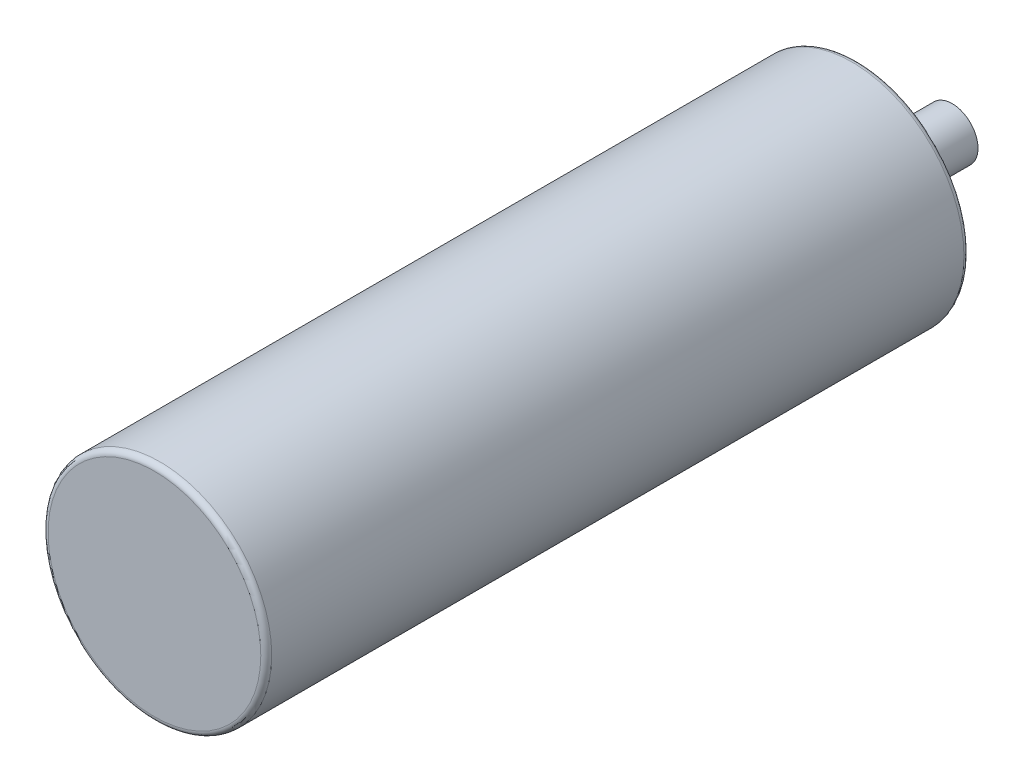
from build123d import *

# Parameters (mm, degrees)
SKETCH1_R                 = 26
BODY_DEPTH                = 163.5
SKETCH2_R                 = 6
AXLE_DEPTH                = 22
FLAT_START                = -15
SKETCH3_R                 = 1.016
FLAT_DEPTH                = 15
M5X0_8_TAPPED_HOLE1_D     = 4.2
M5X0_8_TAPPED_HOLE1_DEPTH = 32.0000122
M5X0_8_TAPPED_HOLE1_TIP   = 1.2618073
FILLET1_R                 = 1.27


with BuildPart() as part:
    # Sketch1 → body (new body)
    with BuildSketch(Plane.XY):
        Circle(SKETCH1_R)
    extrude(amount=BODY_DEPTH)

    # Sketch2 → axle (add)
    with BuildSketch(Plane(origin=(0, 0, 0), x_dir=(-1, 0, 0), z_dir=(0, 0, -1))):
        with Locations(Location((0, 0, 0), (0, 0, 180))):
            Circle(SKETCH2_R)
    extrude(amount=AXLE_DEPTH)

    # Sketch3 → flat (cut)
    with BuildSketch(Plane(origin=(0, 0, -22), x_dir=(-1, 0, 0), z_dir=(0, 0, -1)).offset(FLAT_START)):
        with BuildLine():
            Line((4.472135955, -4), (-4.472135955, -4))
            ThreePointArc((-4.472135955, -4), (0, -6), (4.472135955, -4))
        make_face()
        Circle(SKETCH3_R)
    extrude(amount=FLAT_DEPTH, mode=Mode.SUBTRACT)

    # M5x0.8 Tapped Hole1
    with Locations(Plane(origin=(0, 0, 0), x_dir=(-1, 0, 0), z_dir=(0, 0, -1))):
        with Locations((0, -20), (-20, 0), (0, 20), (20, 0)):
            Hole(M5X0_8_TAPPED_HOLE1_D / 2, depth=M5X0_8_TAPPED_HOLE1_DEPTH)
            with Locations((0, 0, -(M5X0_8_TAPPED_HOLE1_DEPTH + M5X0_8_TAPPED_HOLE1_TIP / 2))):  # 118° drill point
                Cone(0, M5X0_8_TAPPED_HOLE1_D / 2, M5X0_8_TAPPED_HOLE1_TIP, mode=Mode.SUBTRACT)

    # Fillet1
    fillet1_edges = [part.edges().sort_by_distance(p)[0] for p in [
        (-26, 0, 0),
        (-26, 0, 163.5),
    ]]
    fillet(fillet1_edges, radius=FILLET1_R)


solid = part.part
